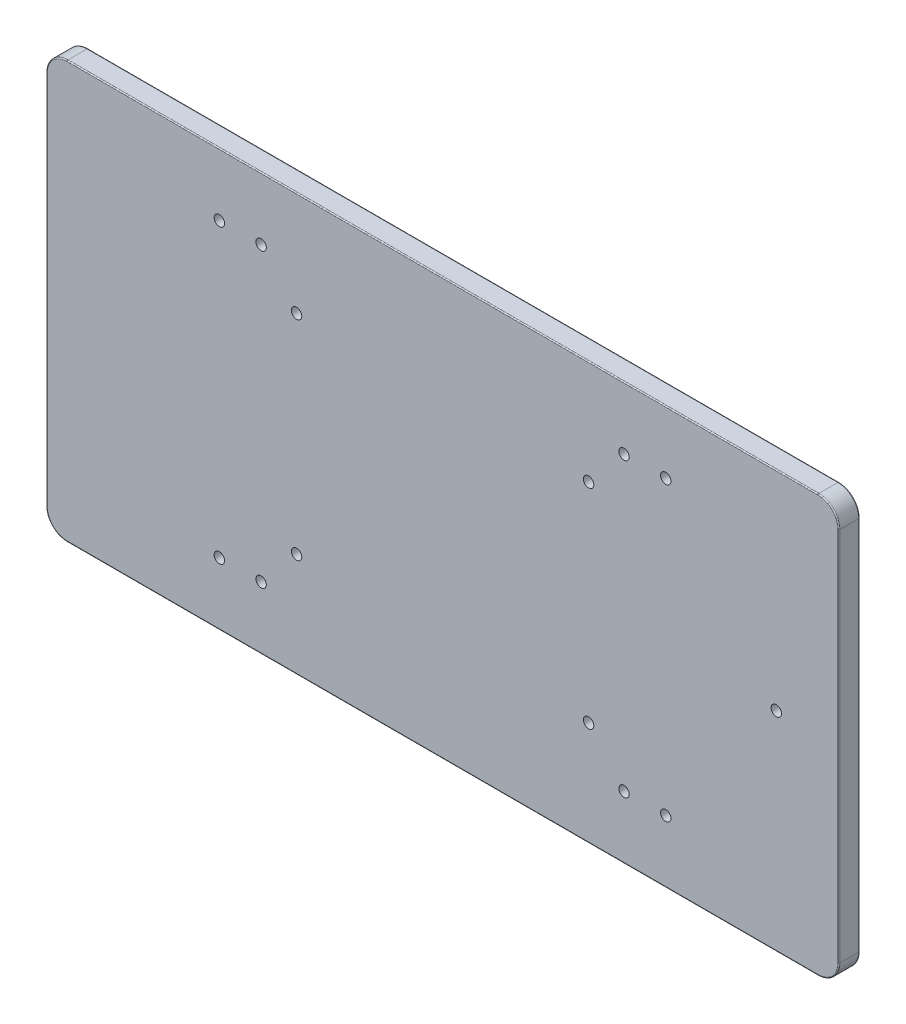
from build123d import *

# Parameters (mm, degrees)
SKETCH1_W           = 190
SKETCH1_H           = 100
SKETCH1_R           = 1.25
BOSS_EXTRUDE1_DEPTH = 5
FILLET1_R           = 5
FILLET2_R           = 0.25


with BuildPart() as part:
    # Sketch1 → Boss-Extrude1 (new body)
    with BuildSketch(Plane.XY):
        Rectangle(SKETCH1_W, SKETCH1_H)
        with Locations((-43.5, -35)):
            Circle(SKETCH1_R, mode=Mode.SUBTRACT)
        with Locations((-53.5, -35)):
            Circle(SKETCH1_R, mode=Mode.SUBTRACT)
        with Locations((-35, -25)):
            Circle(SKETCH1_R, mode=Mode.SUBTRACT)
        with Locations((-35, 25)):
            Circle(SKETCH1_R, mode=Mode.SUBTRACT)
        with Locations((35, 25)):
            Circle(SKETCH1_R, mode=Mode.SUBTRACT)
        with Locations((35, -25)):
            Circle(SKETCH1_R, mode=Mode.SUBTRACT)
        with Locations(Location((43.5, -35, 0), (0, 0, 180))):
            Circle(SKETCH1_R, mode=Mode.SUBTRACT)
        with Locations(Location((53.5, -35, 0), (0, 0, 180))):
            Circle(SKETCH1_R, mode=Mode.SUBTRACT)
        with Locations((53.5, 35)):
            Circle(SKETCH1_R, mode=Mode.SUBTRACT)
        with Locations((43.5, 35)):
            Circle(SKETCH1_R, mode=Mode.SUBTRACT)
        with Locations(Location((-53.5, 35, 0), (0, 0, 180))):
            Circle(SKETCH1_R, mode=Mode.SUBTRACT)
        with Locations(Location((-43.5, 35, 0), (0, 0, 180))):
            Circle(SKETCH1_R, mode=Mode.SUBTRACT)
        with Locations((80, 0)):
            Circle(SKETCH1_R, mode=Mode.SUBTRACT)
    extrude(amount=BOSS_EXTRUDE1_DEPTH)

    # Fillet1
    fillet1_edges = [part.edges().sort_by_distance(p)[0] for p in [
        (-95, 50, 2.5),
        (95, 50, 2.5),
        (95, -50, 2.5),
        (-95, -50, 2.5),
    ]]
    fillet(fillet1_edges, radius=FILLET1_R)

    # Fillet2
    fillet2_edges = [part.edges().sort_by_distance(p)[0] for p in [
        (0, 50, 0),
        (0, 50, 5),
        (-95, 0, 0),
        (95, 0, 0),
        (0, -50, 0),
        (-93.535533906, 48.535533906, 0),
        (-93.535533906, -48.535533906, 0),
        (93.535533906, -48.535533906, 0),
        (93.535533906, 48.535533906, 0),
        (95, 0, 5),
        (-95, 0, 5),
        (0, -50, 5),
        (-93.535533906, 48.535533906, 5),
        (-93.535533906, -48.535533906, 5),
        (93.535533906, -48.535533906, 5),
        (93.535533906, 48.535533906, 5),
    ]]
    fillet(fillet2_edges, radius=FILLET2_R)


solid = part.part
